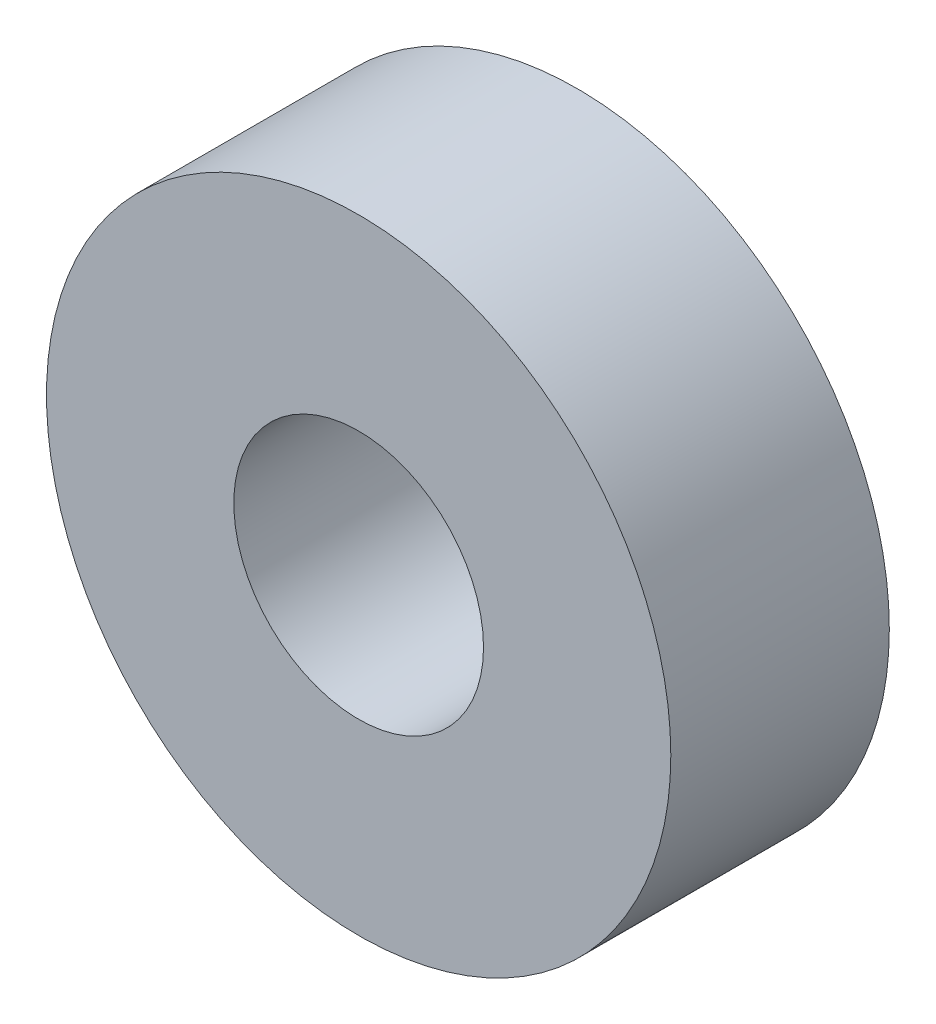
from build123d import *

# Parameters (mm, degrees)
SKETCH1_R           = 10
SKETCH1_R_2         = 4
BOSS_EXTRUDE1_DEPTH = 7


with BuildPart() as part:
    # Sketch1 → Boss-Extrude1 (new body)
    with BuildSketch(Plane.XY):
        Circle(SKETCH1_R)
        Circle(SKETCH1_R_2, mode=Mode.SUBTRACT)
    extrude(amount=BOSS_EXTRUDE1_DEPTH)


solid = part.part
